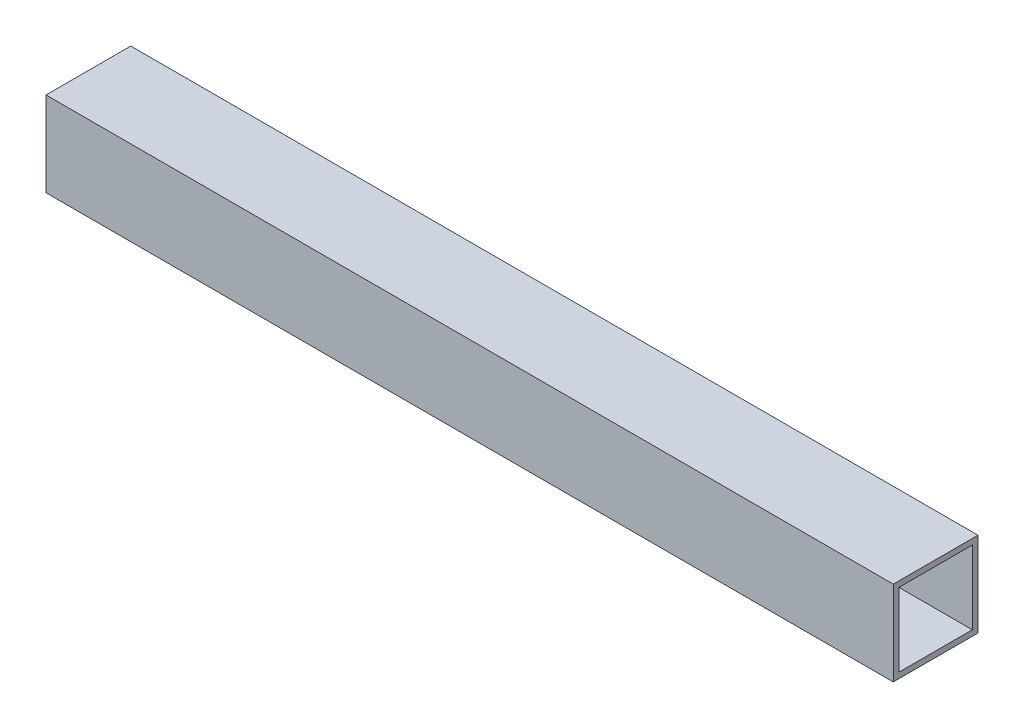
from build123d import *

# Parameters (mm, degrees)
SKETCH_1_W      = 15
SKETCH_1_H      = 15
SKETCH_1_W_2    = 13
SKETCH_1_H_2    = 13
EXTRUDE_1_DEPTH = 75


with BuildPart() as part:
    # 草图1 → 凸台-拉伸1 (new, symmetric)
    with BuildSketch(Plane(origin=(0, 0, 0), x_dir=(0, 0, -1), z_dir=(1, 0, 0))):
        Rectangle(SKETCH_1_W, SKETCH_1_H)
        Rectangle(SKETCH_1_W_2, SKETCH_1_H_2, mode=Mode.SUBTRACT)
    extrude(amount=EXTRUDE_1_DEPTH, both=True)


solid = part.part
